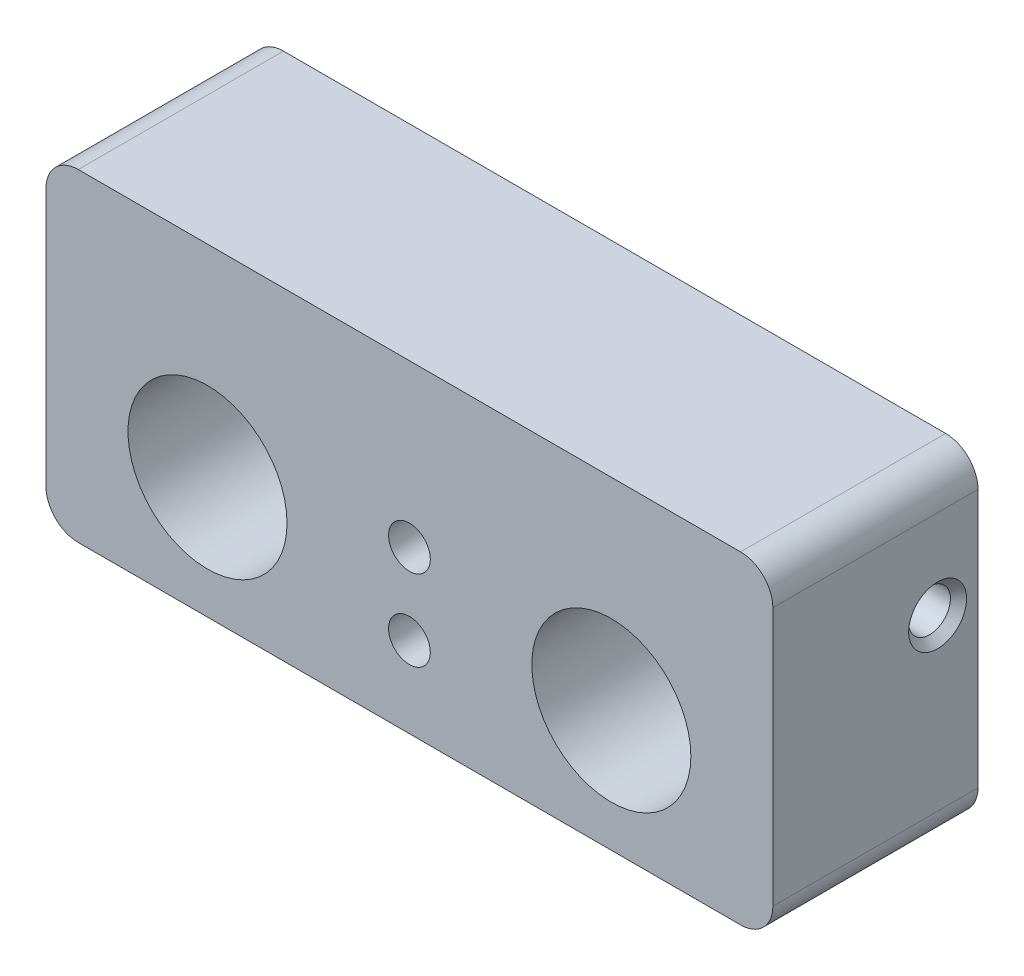
from build123d import *

# Parameters (mm, degrees)
SKETCH1_W                       = 45
SKETCH1_H                       = 20
SKETCH1_R                       = 4.9235
BOSS_EXTRUDE1_DEPTH             = 12.7
TAP_DRILL_FOR_M3X0_5_TAP1_D     = 2.584625
TAP_DRILL_FOR_M3X0_5_TAP1_DEPTH = 10
TAP_DRILL_FOR_M3X0_5_TAP1_TIP   = 0.776499689
FILLET1_R                       = 2
CHAMFER1_SIZE                   = 0.5


with BuildPart() as part:
    # Sketch1 → Boss-Extrude1 (new body)
    with BuildSketch(Plane.XY):
        with Locations((5.818965517, -6.284482759)):
            Rectangle(SKETCH1_W, SKETCH1_H)
        with Locations((-6.681034483, -8.784482759)):
            Circle(SKETCH1_R, mode=Mode.SUBTRACT)
        with Locations((18.318965517, -8.784482759)):
            Circle(SKETCH1_R, mode=Mode.SUBTRACT)
    extrude(amount=BOSS_EXTRUDE1_DEPTH)

    # Tap Drill for M3x0.5 Tap1
    with Locations(Plane.XY.offset(12.7)):
        with Locations((5.818965517, -6.284482759), (5.818965517, -11.284482759)):
            Hole(TAP_DRILL_FOR_M3X0_5_TAP1_D / 2, depth=TAP_DRILL_FOR_M3X0_5_TAP1_DEPTH)
            with Locations((0, 0, -(TAP_DRILL_FOR_M3X0_5_TAP1_DEPTH + TAP_DRILL_FOR_M3X0_5_TAP1_TIP / 2))):  # 118° drill point
                Cone(0, TAP_DRILL_FOR_M3X0_5_TAP1_D / 2, TAP_DRILL_FOR_M3X0_5_TAP1_TIP, mode=Mode.SUBTRACT)

    # Fillet1
    fillet1_edges = [part.edges().sort_by_distance(p)[0] for p in [
        (-16.681034483, 3.715517241, 6.35),
        (28.318965517, 3.715517241, 6.35),
        (28.318965517, -16.284482759, 6.35),
        (-16.681034483, -16.284482759, 6.35),
    ]]
    fillet(fillet1_edges, radius=FILLET1_R)

    # Sketch8 → Tap Drill for M3x0.5 Tap2 (revolve, cut)
    with BuildSketch(Plane(origin=(-16.681034483, -3.784482759, 2.5), x_dir=(0, 0, 1), z_dir=(0, 1, 0))):
        Polygon((0, 0), (0, 5.776499689), (1.2923125, 5), (1.2923125, 0), align=None)
    tap_drill_for_m3x0_5_tap2 = revolve(axis=Axis((-23.031034483, -3.784482759, 2.5), (1, 0, 0)), mode=Mode.SUBTRACT)

    # Mirror3: Tap Drill for M3x0.5 Tap2 across plane
    add(tap_drill_for_m3x0_5_tap2.mirror(Plane(origin=(5.818965517, 0, 0), x_dir=(0, 0, 1), z_dir=(1, 0, 0))), mode=Mode.SUBTRACT)

    # Chamfer1
    chamfer1_edges = [part.edges().sort_by_distance(p)[0] for p in [
        (-16.681034483, -3.784482759, 1.2076875),
        (28.318965517, -3.784482759, 1.2076875),
    ]]
    chamfer(chamfer1_edges, length=CHAMFER1_SIZE)


solid = part.part
